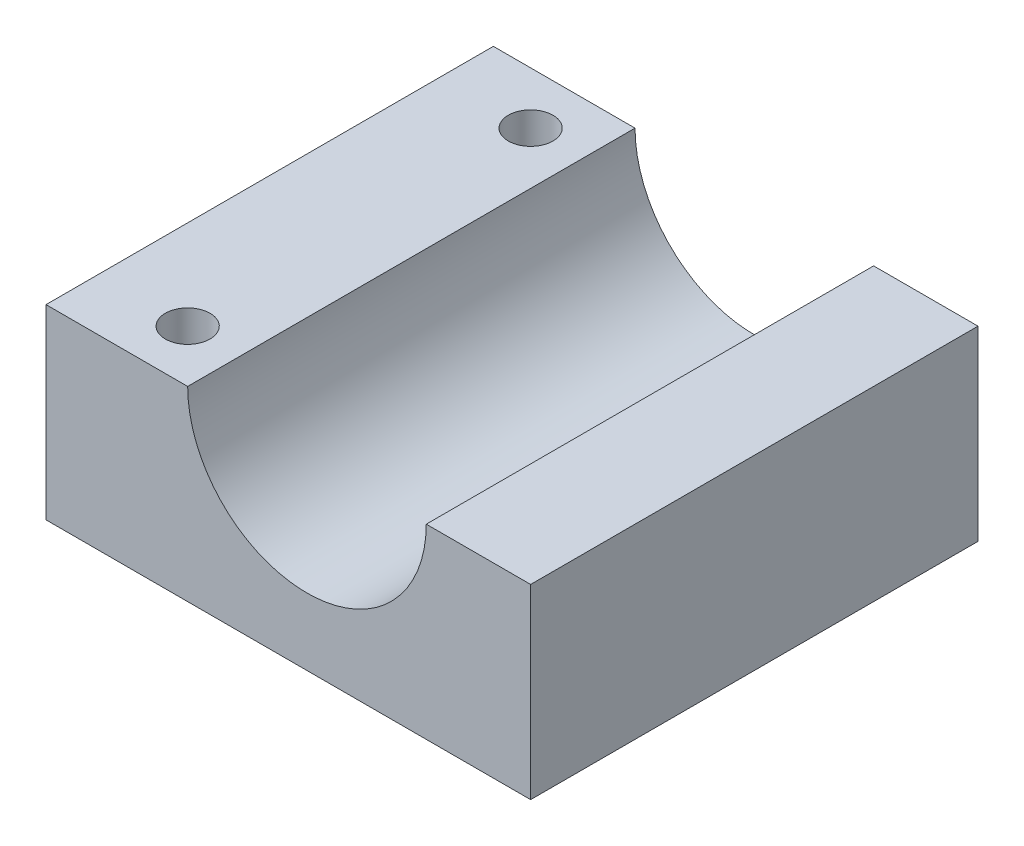
from build123d import *

# Parameters (mm, degrees)
BOSS_EXTRUDE1_DEPTH = 30
SKETCH2_R           = 1.5
CUT_EXTRUDE1_DEPTH  = 40.819488185
SKETCH3_W           = 30
SKETCH3_H           = 12.5
BOSS_EXTRUDE2_DEPTH = 2.5


with BuildPart() as part:
    # Sketch1 → Boss-Extrude1 (new body)
    with BuildSketch(Plane.XY):
        with BuildLine():
            Line((16.007425743, 3.681930693), (23.007425743, 3.681930693))
            Line((23.007425743, 3.681930693), (23.007425743, -8.818069307))
            Line((23.007425743, -8.818069307), (-6.992574257, -8.818069307))
            Line((-6.992574257, -8.818069307), (-6.992574257, 3.681930693))
            Line((-6.992574257, 3.681930693), (0.007425743, 3.681930693))
            ThreePointArc((0.007425743, 3.681930693), (8.007425743, -4.318069307), (16.007425743, 3.681930693))
        make_face()
    extrude(amount=BOSS_EXTRUDE1_DEPTH)

    # Sketch2 → Cut-Extrude1 (cut, through all)
    with BuildSketch(Plane.XZ.offset(8.818069307)):
        with Locations(Location((-3.492574257, 3.5, 0), (0, 0, 270))):
            Circle(SKETCH2_R)
        with Locations(Location((-3.492574257, 26.5, 0), (0, 0, 270))):
            Circle(SKETCH2_R)
    extrude(amount=-CUT_EXTRUDE1_DEPTH, mode=Mode.SUBTRACT)

    # Sketch3 → Boss-Extrude2 (add)
    with BuildSketch(Plane.ZY.offset(6.992574257)):
        with Locations((15, -2.568069307)):
            Rectangle(SKETCH3_W, SKETCH3_H)
    extrude(amount=BOSS_EXTRUDE2_DEPTH)


solid = part.part
